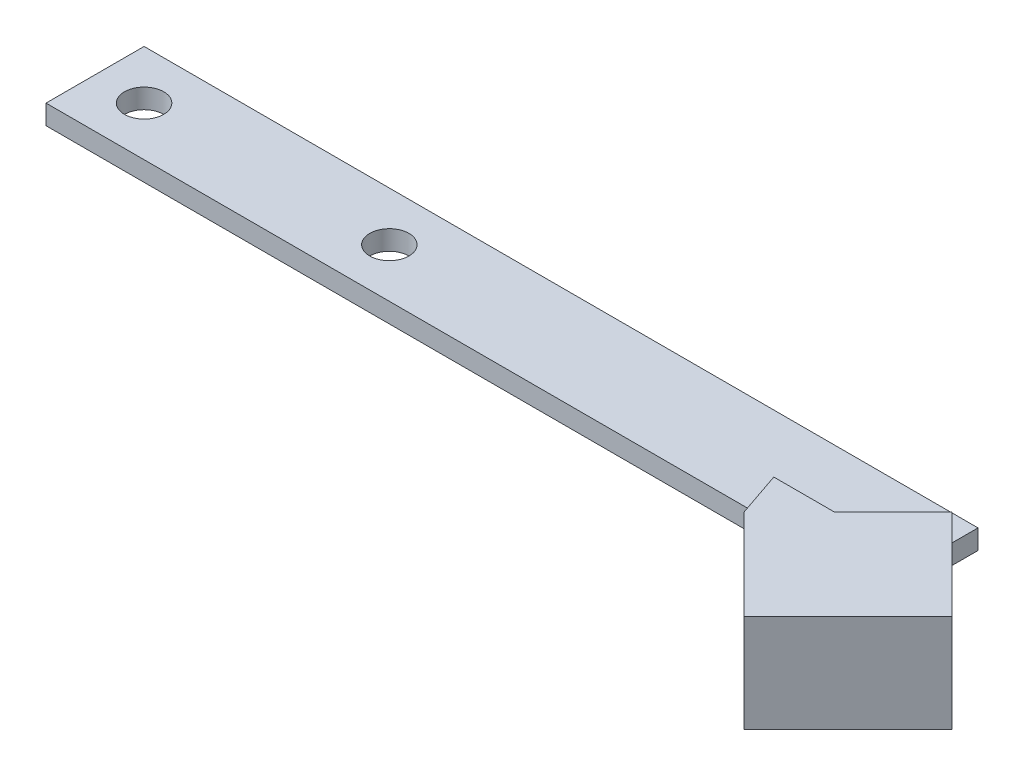
from build123d import *

# Parameters (mm, degrees)
SKETCH1_W           = 85
SKETCH1_H           = 10
SKETCH1_R           = 2
BOSS_EXTRUDE1_DEPTH = 2
CUT_EXTRUDE1_DEPTH  = 10
SKETCH3_W           = 15
SKETCH3_H           = 10
BOSS_EXTRUDE2_DEPTH = 13
BOSS_EXTRUDE3_DEPTH = 10


with BuildPart() as part:
    # Sketch1 → Boss-Extrude1 (new body)
    with BuildSketch(Plane(origin=(0, 0, 0), x_dir=(1, 0, 0), z_dir=(0, 1, 0))):
        with Locations((18.270818553, 2.053936679)):
            Rectangle(SKETCH1_W, SKETCH1_H)
        with Locations(Location((-19.229181447, 2.053936679, 0), (0, 0, 270))):
            Circle(SKETCH1_R, mode=Mode.SUBTRACT)
        with Locations(Location((5.770818553, 2.053936679, 0), (0, 0, 270))):
            Circle(SKETCH1_R, mode=Mode.SUBTRACT)
    extrude(amount=BOSS_EXTRUDE1_DEPTH)

    # Sketch2 → Cut-Extrude1 (cut)
    with BuildSketch(Plane(origin=(0, 2, 0), x_dir=(1, 0, 0), z_dir=(0, 1, 0))):
        Polygon((60.770818553, 2.053936679), (55.770818553, -2.946063321), (60.770818553, -2.946063321), align=None)
    extrude(amount=-CUT_EXTRUDE1_DEPTH, mode=Mode.SUBTRACT)

    # Sketch3 → Boss-Extrude2 (add)
    with BuildSketch(Plane(origin=(29.358440937, 0, 29.358440937), x_dir=(0.7071067811865439, 0, -0.7071067811865511), z_dir=(0.7071067811865511, 0, 0.7071067811865439))):
        with Locations((38.590339713, 0.888307249)):
            Rectangle(SKETCH3_W, SKETCH3_H)
    extrude(amount=BOSS_EXTRUDE2_DEPTH)

    # Sketch4 → Boss-Extrude3 (add)
    with BuildSketch(Plane(origin=(0, 5.888307249, 0), x_dir=(1, 0, 0), z_dir=(0, 1, 0))):
        Polygon((51.342630977, -7.374250897), (49.762527896, -2.752596668), (55.964285206, -2.752596668), align=None)
    extrude(amount=-BOSS_EXTRUDE3_DEPTH)


solid = part.part
